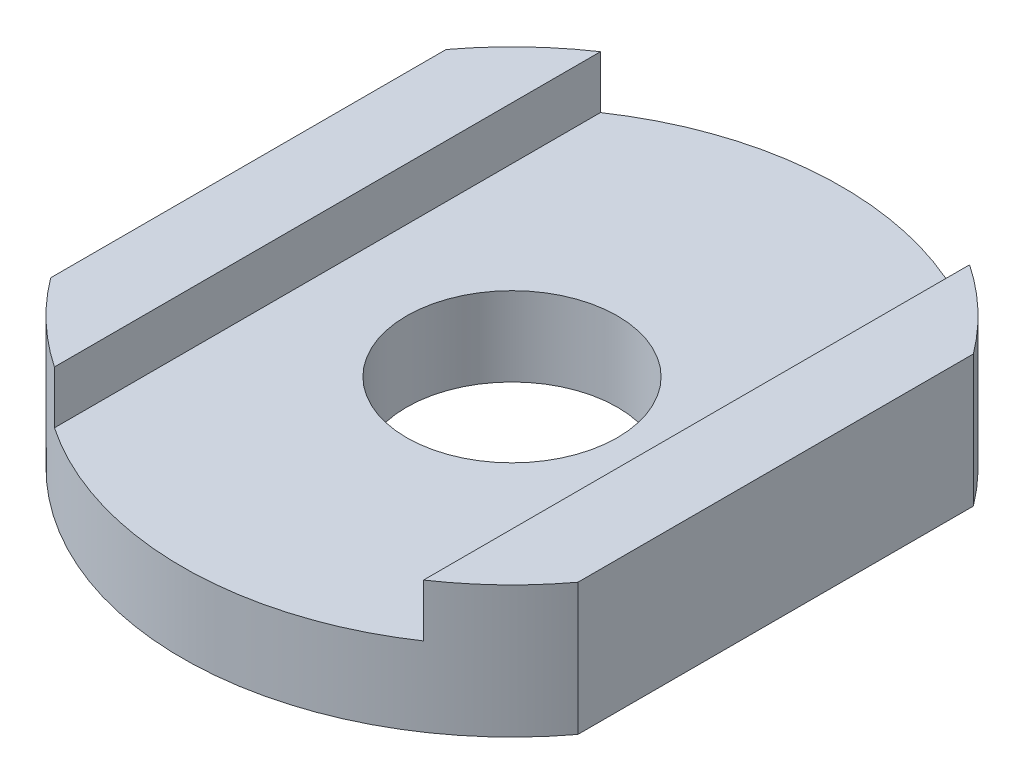
from build123d import *

# Parameters (mm, degrees)
SKETCH1_R           = 4
BOSS_EXTRUDE1_DEPTH = 3
BOSS_EXTRUDE2_DEPTH = 5


with BuildPart() as part:
    # Sketch1 → Boss-Extrude1 (new body)
    with BuildSketch(Plane(origin=(0, 0, 0), x_dir=(1, 0, 0), z_dir=(0, 1, 0))):
        with BuildLine():
            Line((7, -10.356157589), (7, 10.356157589))
            ThreePointArc((7, 10.356157589), (0, 12.5), (-7, 10.356157589))
            Line((-7, 10.356157589), (-7, -10.356157589))
            ThreePointArc((-7, -10.356157589), (0, -12.5), (7, -10.356157589))
        make_face()
        Circle(SKETCH1_R, mode=Mode.SUBTRACT)
    extrude(amount=BOSS_EXTRUDE1_DEPTH)

    # Sketch1<3> → Boss-Extrude2 (add)
    with BuildSketch(Plane(origin=(0, 0, 0), x_dir=(1, 0, 0), z_dir=(0, 1, 0))):
        with BuildLine():
            ThreePointArc((10, 7.5), (8.619130411, 9.053208876), (7, 10.356157589))
            Line((7, 10.356157589), (7, -10.356157589))
            ThreePointArc((7, -10.356157589), (8.619130411, -9.053208876), (10, -7.5))
            Line((10, -7.5), (10, 7.5))
        make_face()
        with BuildLine():
            Line((-7, -10.356157589), (-7, 10.356157589))
            ThreePointArc((-7, 10.356157589), (-8.619130411, 9.053208876), (-10, 7.5))
            Line((-10, 7.5), (-10, -7.5))
            ThreePointArc((-10, -7.5), (-8.619130411, -9.053208876), (-7, -10.356157589))
        make_face()
    extrude(amount=BOSS_EXTRUDE2_DEPTH)


solid = part.part
